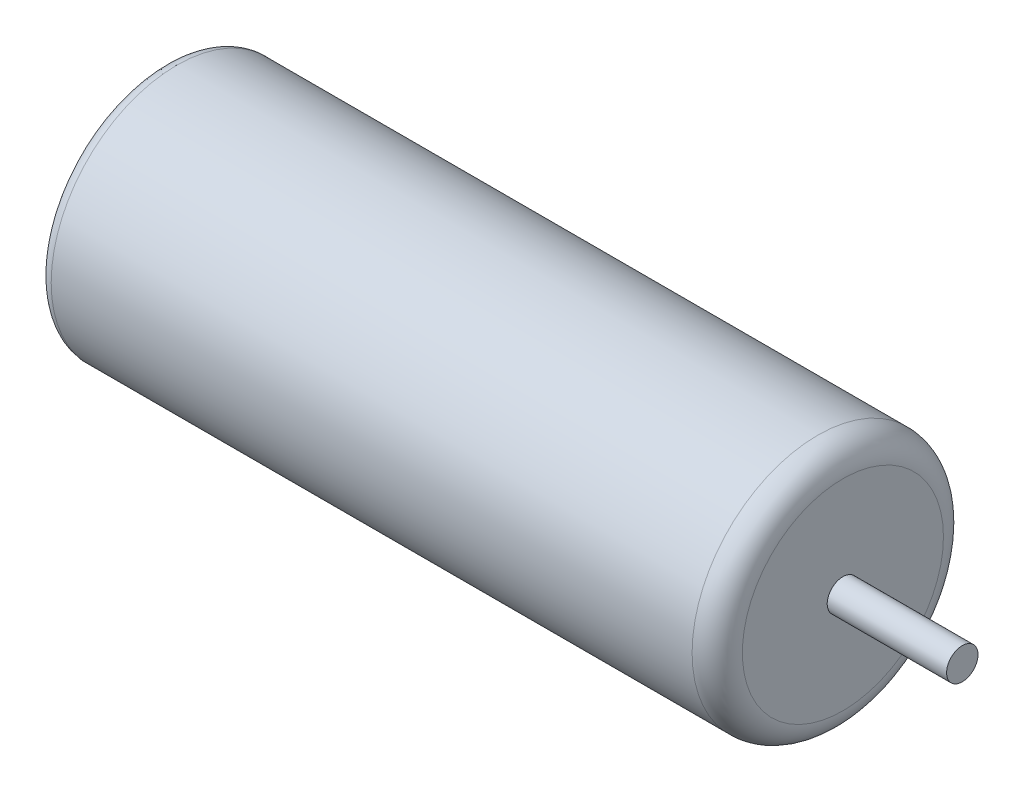
from build123d import *

# Parameters (mm, degrees)
SKETCH1_R           = 20
BOSS_EXTRUDE1_DEPTH = 108
SKETCH2_R           = 2.5
BOSS_EXTRUDE2_DEPTH = 19
FILLET1_R           = 2
FILLET2_R           = 4


with BuildPart() as part:
    # Sketch1 → Boss-Extrude1 (new body)
    with BuildSketch(Plane(origin=(0, 0, 0), x_dir=(0, 0, -1), z_dir=(1, 0, 0))):
        Circle(SKETCH1_R)
    extrude(amount=BOSS_EXTRUDE1_DEPTH)

    # Sketch2 → Boss-Extrude2 (add)
    with BuildSketch(Plane(origin=(108, 0, 0), x_dir=(0, 0, -1), z_dir=(1, 0, 0))):
        Circle(SKETCH2_R)
    extrude(amount=BOSS_EXTRUDE2_DEPTH)

    # Fillet1
    fillet1_edges = [part.edges().sort_by_distance(p)[0] for p in [
        (0, 0, 20),
    ]]
    fillet(fillet1_edges, radius=FILLET1_R)

    # Fillet2
    fillet2_edges = [part.edges().sort_by_distance(p)[0] for p in [
        (108, 0, 20),
    ]]
    fillet(fillet2_edges, radius=FILLET2_R)


solid = part.part
